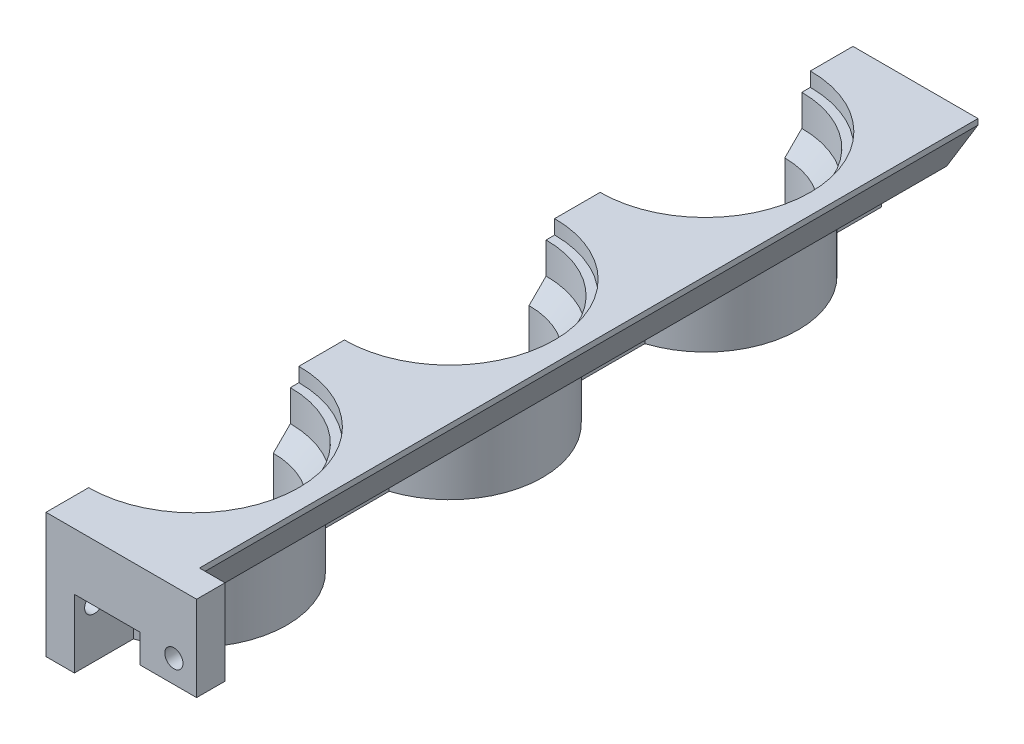
from build123d import *

# Parameters (mm, degrees)
BOSS_EXTRUDE1_DEPTH = 10
BOSS_EXTRUDE2_DEPTH = 12
CHAMFER2_SIZE       = 5.5
CHAMFER2_SIZE2      = 9
SKETCH6_W           = 14
SKETCH6_H           = 15
SKETCH6_W_2         = 17
SKETCH6_H_2         = 2.5
SKETCH6_W_3         = 1.5
LPATTERN3_COUNT     = 3
LPATTERN3_PITCH     = 45
SKETCH7_R           = 1.7
CUT_EXTRUDE1_DEPTH  = 10
LPATTERN4_COUNT     = 3
LPATTERN4_PITCH     = 45
LPATTERN5_COUNT     = 2
LPATTERN5_PITCH     = 45
SKETCH8_W           = 10
SKETCH8_H           = 15
SKETCH8_R           = 1.6
BOSS_EXTRUDE3_DEPTH = 5


with BuildPart() as part:
    # Sketch1 → Boss-Extrude1 (new body)
    with BuildSketch(Plane(origin=(0, 0, 0), x_dir=(1, 0, 0), z_dir=(0, 1, 0))):
        with BuildLine():
            Line((0, -11.4), (0, -26))
            Line((0, -26), (22, -26))
            Line((22, -26), (22, 116))
            Line((22, 116), (0, 116))
            Line((0, 116), (0, 101.4))
            ThreePointArc((0, 101.4), (11.4, 90), (0, 78.6))
            Line((0, 78.6), (0, 56.4))
            ThreePointArc((0, 56.4), (11.4, 45), (0, 33.6))
            Line((0, 33.6), (0, 11.4))
            ThreePointArc((0, 11.4), (11.4, 0), (0, -11.4))
        make_face()
    extrude(amount=-BOSS_EXTRUDE1_DEPTH)

    # Sketch3 → Boss-Extrude2 (add)
    with BuildSketch(Plane.XZ.offset(10)):
        with BuildLine():
            Line((0, -116), (0, -101.4))
            ThreePointArc((0, -101.4), (11.4, -90), (0, -78.6))
            Line((0, -78.6), (0, -56.4))
            ThreePointArc((0, -56.4), (11.4, -45), (0, -33.6))
            Line((0, -33.6), (0, -11.4))
            ThreePointArc((0, -11.4), (11.4, 0), (0, 11.4))
            Line((0, 11.4), (0, 26))
            Line((0, 26), (5, 26))
            Line((5, 26), (5, 15.619218931))
            ThreePointArc((5, 15.619218931), (16.4, 0), (5, -15.619218931))
            Line((5, -15.619218931), (5, -29.380781069))
            ThreePointArc((5, -29.380781069), (16.4, -45), (5, -60.619218931))
            Line((5, -60.619218931), (5, -74.380781069))
            ThreePointArc((5, -74.380781069), (16.4, -90), (5, -105.619218931))
            Line((5, -105.619218931), (5, -116))
            Line((5, -116), (0, -116))
        make_face()
    extrude(amount=BOSS_EXTRUDE2_DEPTH)

    # Chamfer2
    chamfer2_edges = [part.edges().sort_by_distance(p)[0] for p in [
        (22, -10, -45),
    ]]
    chamfer2_side = [part.faces().sort_by_distance(p)[0] for p in [
        (6.430139853, -10, 20.809609465),
    ]]
    chamfer(chamfer2_edges, length=CHAMFER2_SIZE, length2=CHAMFER2_SIZE2, reference=chamfer2_side[0])

    # Sketch6 → Cut-Revolve6 (revolve, cut)
    with BuildSketch(Plane.ZY):
        with Locations((-83, -18.5)):
            Rectangle(SKETCH6_W, SKETCH6_H)
        Polygon((-90, -11), (-76, -11), (-73, -8), (-73, -2.5), (-90, -2.5), align=None)
        with Locations((-81.5, -1.25)):
            Rectangle(SKETCH6_W_2, SKETCH6_H_2)
        with Locations((-72.25, -1.25)):
            Rectangle(SKETCH6_W_3, SKETCH6_H_2)
    cut_revolve6 = revolve(axis=Axis((0, 0, -90), (0, -1, 0)), mode=Mode.SUBTRACT)

    # LPattern3: Cut-Revolve6 ×3
    with Locations(*[(0, 0, i * LPATTERN3_PITCH) for i in range(1, LPATTERN3_COUNT)]):
        add(cut_revolve6, mode=Mode.SUBTRACT)

    # Sketch7 → Cut-Extrude1 (cut)
    with BuildSketch(Plane(origin=(5, 0, 0), x_dir=(0, 0, -1), z_dir=(1, 0, 0))):
        with Locations((67.5, -13)):
            Circle(SKETCH7_R)
    cut_extrude1 = extrude(amount=-CUT_EXTRUDE1_DEPTH, mode=Mode.SUBTRACT)

    # LPattern4: Cut-Extrude1 ×3
    with Locations(*[(0, 0, i * LPATTERN4_PITCH) for i in range(1, LPATTERN4_COUNT)]):
        add(cut_extrude1, mode=Mode.SUBTRACT)

    # LPattern5: Cut-Extrude1 ×2
    with Locations(*[(0, 0, -i * LPATTERN5_PITCH) for i in range(1, LPATTERN5_COUNT)]):
        add(cut_extrude1, mode=Mode.SUBTRACT)

    # Sketch8 → Boss-Extrude3 (add)
    with BuildSketch(Plane.XY.offset(26)):
        with Locations((21.5, -7.5)):
            Rectangle(SKETCH8_W, SKETCH8_H)
        with Locations((22.5, -11)):
            Circle(SKETCH8_R, mode=Mode.SUBTRACT)
    extrude(amount=-BOSS_EXTRUDE3_DEPTH)


solid = part.part
